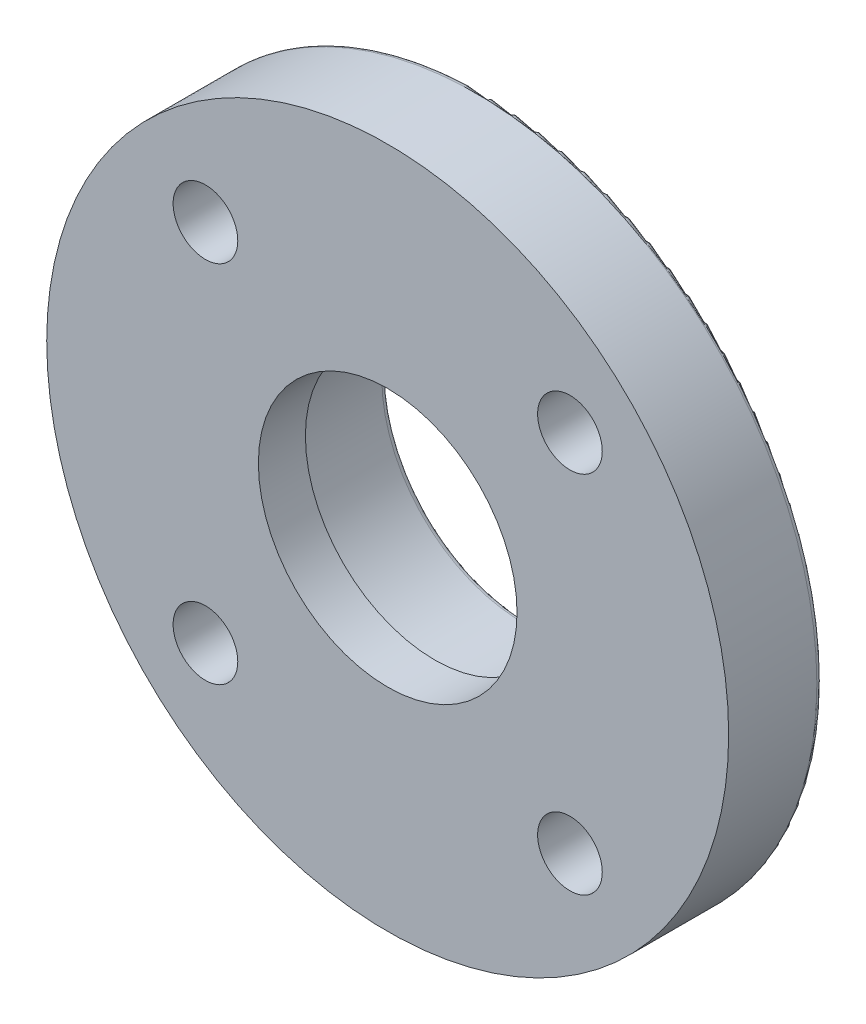
from build123d import *

# Parameters (mm, degrees)
CROQUIS1_R              = 29
CROQUIS1_R_2            = 2.75
CROQUIS1_R_3            = 12
SALIENTE_EXTRUIR1_DEPTH = 8
CROQUIS2_R              = 16
CROQUIS2_R_2            = 12
SALIENTE_EXTRUIR2_DEPTH = 4
SALIENTE_EXTRUIR3_START = -4
CROQUIS3_R              = 12
CROQUIS3_R_2            = 11
SALIENTE_EXTRUIR3_DEPTH = 4
REDONDEO2_R             = 0.5


with BuildPart() as part:
    # Croquis1 → Saliente-Extruir1 (new body)
    with BuildSketch(Plane.XY):
        Circle(CROQUIS1_R)
        with Locations((-15.5, 15.5)):
            Circle(CROQUIS1_R_2, mode=Mode.SUBTRACT)
        with Locations((15.5, 15.5)):
            Circle(CROQUIS1_R_2, mode=Mode.SUBTRACT)
        with Locations((15.5, -15.5)):
            Circle(CROQUIS1_R_2, mode=Mode.SUBTRACT)
        with Locations((-15.5, -15.5)):
            Circle(CROQUIS1_R_2, mode=Mode.SUBTRACT)
        Circle(CROQUIS1_R_3, mode=Mode.SUBTRACT)
    extrude(amount=-SALIENTE_EXTRUIR1_DEPTH)

    # Croquis2 → Saliente-Extruir2 (add)
    with BuildSketch(Plane(origin=(0, 0, -8), x_dir=(-1, 0, 0), z_dir=(0, 0, -1))):
        with Locations(Location((0, 0, 0), (0, 0, 180))):
            Circle(CROQUIS2_R)
        with Locations(Location((0, 0, 0), (0, 0, 180))):
            Circle(CROQUIS2_R_2, mode=Mode.SUBTRACT)
    extrude(amount=SALIENTE_EXTRUIR2_DEPTH)

    # Croquis3 → Saliente-Extruir3 (add)
    with BuildSketch(Plane(origin=(0, 0, -4), x_dir=(-1, 0, 0), z_dir=(0, 0, -1)).offset(SALIENTE_EXTRUIR3_START)):
        Circle(CROQUIS3_R)
        Circle(CROQUIS3_R_2, mode=Mode.SUBTRACT)
    extrude(amount=SALIENTE_EXTRUIR3_DEPTH)

    # Redondeo2
    redondeo2_edges = [part.edges().sort_by_distance(p)[0] for p in [
        (-16, 0, -12),
        (-12, 0, -12),
        (-29, 0, -8),
    ]]
    fillet(redondeo2_edges, radius=REDONDEO2_R)


solid = part.part
